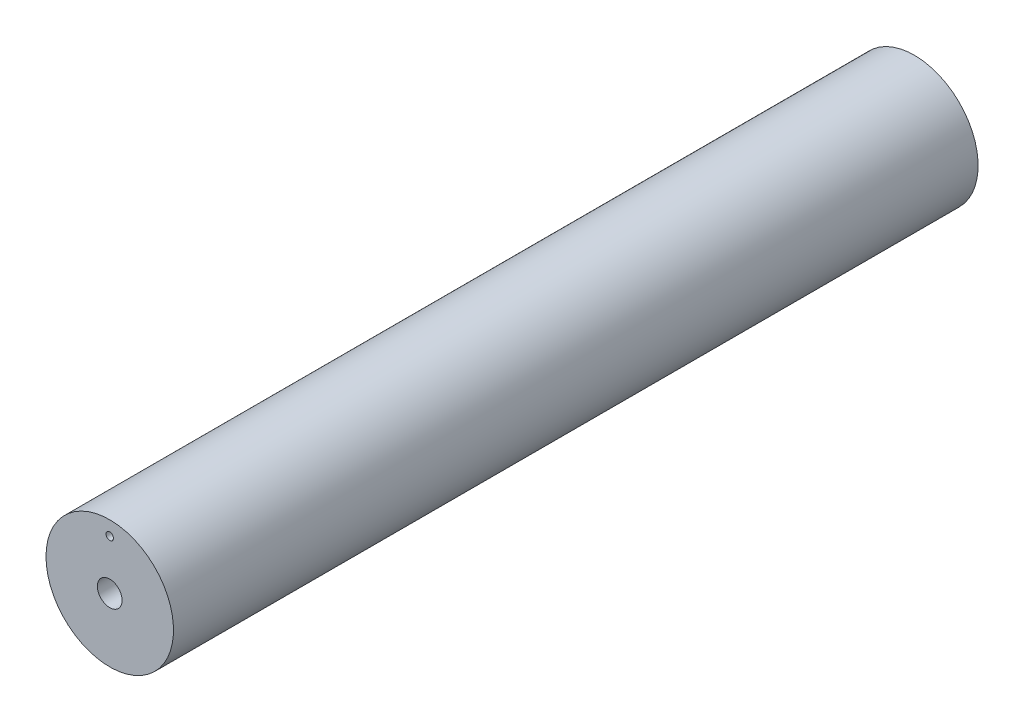
from build123d import *

# Parameters (mm, degrees)
SKETCH2_R          = 5
CUT_EXTRUDE1_DEPTH = 328.033828525
SKETCH3_R          = 1.5
CUT_EXTRUDE2_DEPTH = 10


with BuildPart() as part:
    # Sketch1 → Revolve1 (revolve)
    with BuildSketch(Plane(origin=(0, 0, 0), x_dir=(1, 0, 0), z_dir=(0, 1, 0))):
        Polygon((0, 325), (-25.75, 325), (-25.75, 0), (-5, 0), (-5, 25), (0, 25), align=None)
    revolve(axis=Axis((0, 0, -14.83423913), (0, 0, 1)))

    # Sketch2 → Cut-Extrude1 (cut, through all)
    with BuildSketch(Plane(origin=(0, 0, 0), x_dir=(1, 0, 0), z_dir=(0, 1, 0))):
        with Locations(Location((0, 307.5, 0), (0, 0, 270))):
            Circle(SKETCH2_R)
    extrude(amount=-CUT_EXTRUDE1_DEPTH, mode=Mode.SUBTRACT)

    # Sketch3 → Cut-Extrude2 (cut)
    with BuildSketch(Plane.XY):
        with Locations((0, 20)):
            Circle(SKETCH3_R)
    extrude(amount=-CUT_EXTRUDE2_DEPTH, mode=Mode.SUBTRACT)


solid = part.part
